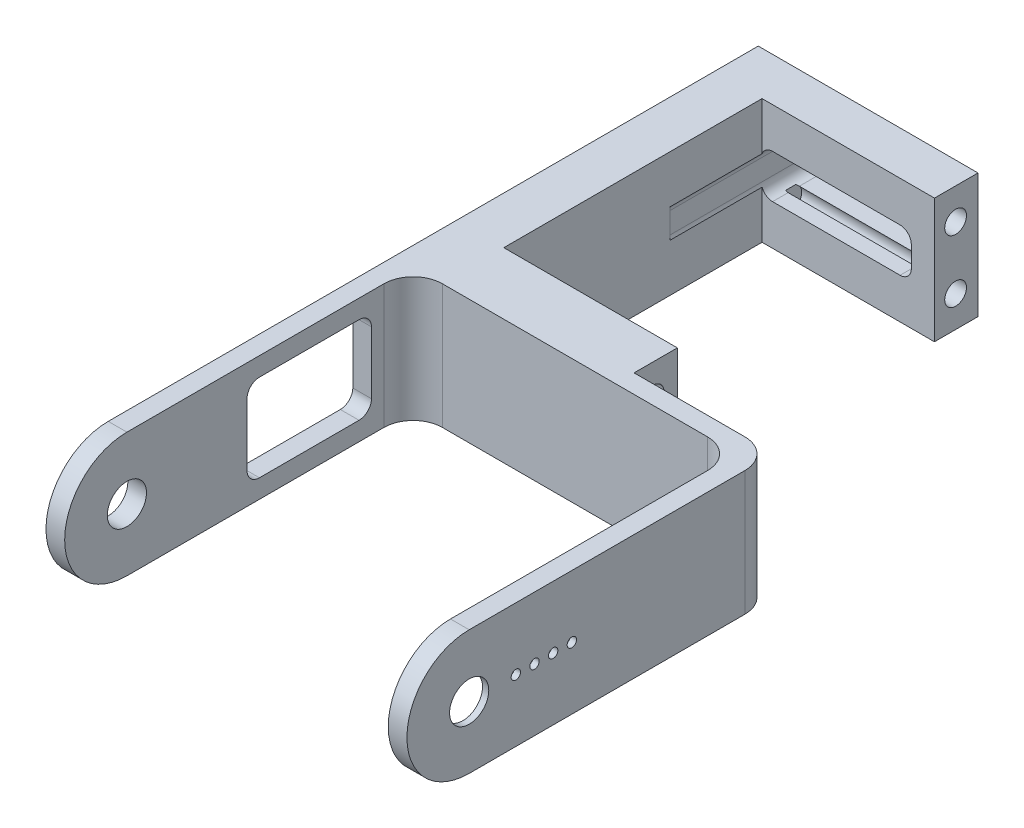
from build123d import *

# Parameters (mm, degrees)
AUFSATZ_LINEAR_AUSTRAGEN1_DEPTH      = 20
SCHNITT_LINEAR_AUSTRAGEN1_DEPTH      = 86.117565755
SKIZZE3_R                            = 3.15
SCHNITT_LINEAR_AUSTRAGEN2_DEPTH      = 86.117565755
SCHNITT_LINEAR_AUSTRAGEN3_DEPTH      = 2
SKIZZE5_R                            = 0.75
SCHNITT_LINEAR_AUSTRAGEN4_DEPTH      = 2
SKIZZE6_W                            = 35.5
SKIZZE6_H                            = 6.955295524
AUFSATZ_LINEAR_AUSTRAGEN2_DEPTH      = 20
SKIZZE7_W                            = 7.611739691
SKIZZE7_H                            = 53.192525908
AUFSATZ_LINEAR_AUSTRAGEN3_DEPTH      = 20
SKIZZE8_W                            = 7
SKIZZE8_H                            = 20
AUFSATZ_LINEAR_AUSTRAGEN4_DEPTH      = 27.7
SCHNITT_LINEAR_AUSTRAGEN5_DEPTH      = 26.48
SCHNITT_LINEAR_AUSTRAGEN6_DEPTH      = 6
SCHNITT_LINEAR_AUSTRAGEN6_DEPTH_BACK = 26.48
SKIZZE10_R                           = 1.75
SKIZZE11_R                           = 3
AUFSATZ_LINEAR_AUSTRAGEN5_DEPTH      = 4
SKIZZE12_W                           = 4.692525908
SKIZZE12_H                           = 20
SCHNITT_LINEAR_AUSTRAGEN7_DEPTH      = 131.901413869
SCHNITT_LINEAR_AUSTRAGEN8_DEPTH      = 6.73


with BuildPart() as part:
    # Skizze1 → Aufsatz-Linear austragen1 (new body)
    with BuildSketch(Plane(origin=(0, 0, 0), x_dir=(1, 0, 0), z_dir=(0, 1, 0))):
        with BuildLine():
            Line((0, 59), (0, 0))
            Line((0, 0), (3, 0))
            Line((3, 0), (3, 51.3))
            ThreePointArc((3, 51.3), (4.376598128, 54.623401872), (7.7, 56))
            Line((7.7, 56), (50.3, 56))
            ThreePointArc((50.3, 56), (53.623401872, 54.623401872), (55, 51.3))
            Line((55, 51.3), (55, 0))
            Line((55, 0), (58, 0))
            Line((58, 0), (58, 54.3))
            ThreePointArc((58, 54.3), (56.623401872, 57.623401872), (53.3, 59))
            Line((53.3, 59), (0, 59))
        make_face()
    extrude(amount=AUFSATZ_LINEAR_AUSTRAGEN1_DEPTH)

    # Skizze2 → Schnitt-Linear austragen1 (cut, through all)
    with BuildSketch(Plane(origin=(58, 0, 0), x_dir=(0, 0, -1), z_dir=(1, 0, 0))):
        with BuildLine():
            ThreePointArc((0, 10), (2.928932188, 17.071067812), (10, 20))
            Line((10, 20), (0, 20))
            Line((0, 20), (0, 10))
        make_face()
        with BuildLine():
            ThreePointArc((10, 0), (2.928932188, 2.928932188), (0, 10))
            Line((0, 10), (0, 0))
            Line((0, 0), (10, 0))
        make_face()
    extrude(amount=-SCHNITT_LINEAR_AUSTRAGEN1_DEPTH, mode=Mode.SUBTRACT)

    # Skizze3 → Schnitt-Linear austragen2 (cut, through all)
    with BuildSketch(Plane(origin=(58, 0, 0), x_dir=(0, 0, -1), z_dir=(1, 0, 0))):
        with Locations((10, 10)):
            Circle(SKIZZE3_R)
    extrude(amount=-SCHNITT_LINEAR_AUSTRAGEN2_DEPTH, mode=Mode.SUBTRACT)

    # Skizze4 → Schnitt-Linear austragen3 (cut)
    with BuildSketch(Plane.ZY.offset(-55)):
        with BuildLine():
            Line((-27.5, 7.5), (-12.823894492, 4.145461598))
            ThreePointArc((-12.823894492, 4.145461598), (-3.5, 10), (-12.823894492, 15.854538402))
            Line((-12.823894492, 15.854538402), (-27.5, 12.5))
            ThreePointArc((-27.5, 12.5), (-30, 10), (-27.5, 7.5))
        make_face()
    extrude(amount=-SCHNITT_LINEAR_AUSTRAGEN3_DEPTH, mode=Mode.SUBTRACT)

    # Skizze5 → Schnitt-Linear austragen4 (cut)
    with BuildSketch(Plane.ZY.offset(-57)):
        with Locations((-26.5, 10)):
            Circle(SKIZZE5_R)
        with Locations((-23.5, 10)):
            Circle(SKIZZE5_R)
        with Locations((-20.5, 10)):
            Circle(SKIZZE5_R)
        with Locations((-17.5, 10)):
            Circle(SKIZZE5_R)
    extrude(amount=-SCHNITT_LINEAR_AUSTRAGEN4_DEPTH, mode=Mode.SUBTRACT)

    # Skizze6 → Aufsatz-Linear austragen2 (add)
    with BuildSketch(Plane.XZ):
        with Locations((17.75, -62.477647762)):
            Rectangle(SKIZZE6_W, SKIZZE6_H)
    extrude(amount=-AUFSATZ_LINEAR_AUSTRAGEN2_DEPTH)

    # Skizze7 → Aufsatz-Linear austragen3 (add)
    with BuildSketch(Plane.XZ):
        with Locations((3.805869846, -92.551558478)):
            Rectangle(SKIZZE7_W, SKIZZE7_H)
    extrude(amount=-AUFSATZ_LINEAR_AUSTRAGEN3_DEPTH)

    # Skizze8 → Aufsatz-Linear austragen4 (add)
    with BuildSketch(Plane(origin=(7.611739691, 0, 0), x_dir=(0, 0, -1), z_dir=(1, 0, 0))):
        with Locations((110.955295524, 10)):
            Rectangle(SKIZZE8_W, SKIZZE8_H)
    extrude(amount=AUFSATZ_LINEAR_AUSTRAGEN4_DEPTH)

    # Skizze9 → Schnitt-Linear austragen5 (cut)
    with BuildSketch(Plane(origin=(0, 0, -119.147821432), x_dir=(-1, 0, 0), z_dir=(0, 0, -1))):
        with BuildLine():
            Line((-9.3, 13.5), (-29.794038703, 13.5))
            ThreePointArc((-29.794038703, 13.5), (-31.066830909, 12.972792206), (-31.594038703, 11.7))
            Line((-31.594038703, 11.7), (-31.594038703, 8.3))
            ThreePointArc((-31.594038703, 8.3), (-31.066830909, 7.027207794), (-29.794038703, 6.5))
            Line((-29.794038703, 6.5), (-9.3, 6.5))
            ThreePointArc((-9.3, 6.5), (-8.027207794, 7.027207794), (-7.5, 8.3))
            Line((-7.5, 8.3), (-7.5, 11.7))
            ThreePointArc((-7.5, 11.7), (-8.027207794, 12.972792206), (-9.3, 13.5))
        make_face()
    extrude(amount=-SCHNITT_LINEAR_AUSTRAGEN5_DEPTH, mode=Mode.SUBTRACT)

    # Skizze10 → Schnitt-Linear austragen6 (cut, two sides: drawn at the far end of the back side and taken through both)
    with BuildSketch(Plane(origin=(35.311739691, 0, 0), x_dir=(0, 0, -1), z_dir=(1, 0, 0)).offset(-SCHNITT_LINEAR_AUSTRAGEN6_DEPTH_BACK)):
        with Locations((62.055295524, 15)):
            Circle(SKIZZE10_R)
        with Locations((62.055295524, 5)):
            Circle(SKIZZE10_R)
        with Locations(Location((110.855295524, 5, 0), (0, 0, 180))):
            Circle(SKIZZE10_R)
        with Locations(Location((110.855295524, 15, 0), (0, 0, 180))):
            Circle(SKIZZE10_R)
    extrude(amount=SCHNITT_LINEAR_AUSTRAGEN6_DEPTH + SCHNITT_LINEAR_AUSTRAGEN6_DEPTH_BACK, mode=Mode.SUBTRACT)

    # Skizze11 → Aufsatz-Linear austragen5 (add)
    with BuildSketch(Plane.ZY):
        with Locations((-96.955295524, 10)):
            Circle(SKIZZE11_R)
    extrude(amount=AUFSATZ_LINEAR_AUSTRAGEN5_DEPTH)

    # Skizze12 → Schnitt-Linear austragen7 (cut, through all)
    with BuildSketch(Plane(origin=(7.611739691, 0, 0), x_dir=(0, 0, -1), z_dir=(1, 0, 0))):
        with Locations((116.801558478, 10)):
            Rectangle(SKIZZE12_W, SKIZZE12_H)
    extrude(amount=-SCHNITT_LINEAR_AUSTRAGEN7_DEPTH, mode=Mode.SUBTRACT)

    # Skizze13 → Schnitt-Linear austragen8 (cut)
    with BuildSketch(Plane.ZY):
        with BuildLine():
            Line((-47.3, 3), (-31.3, 3))
            ThreePointArc((-31.3, 3), (-29.885786438, 3.585786438), (-29.3, 5))
            Line((-29.3, 5), (-29.3, 15))
            ThreePointArc((-29.3, 15), (-29.885786438, 16.414213562), (-31.3, 17))
            Line((-31.3, 17), (-47.3, 17))
            ThreePointArc((-47.3, 17), (-48.714213562, 16.414213562), (-49.3, 15))
            Line((-49.3, 15), (-49.3, 5))
            ThreePointArc((-49.3, 5), (-48.714213562, 3.585786438), (-47.3, 3))
        make_face()
    extrude(amount=-SCHNITT_LINEAR_AUSTRAGEN8_DEPTH, mode=Mode.SUBTRACT)


solid = part.part
